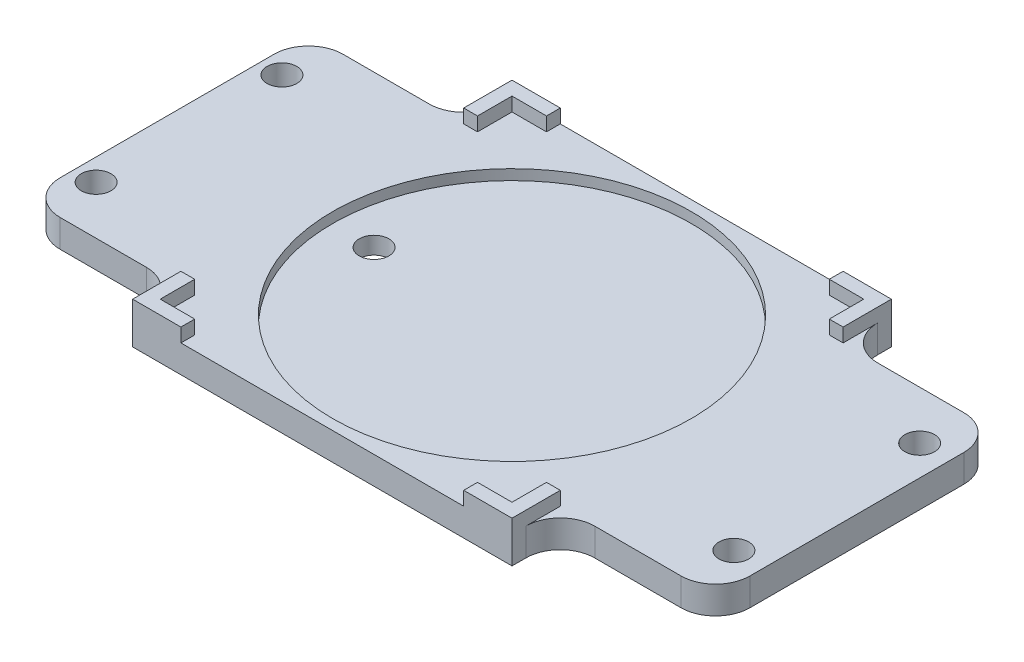
from build123d import *

# Parameters (mm, degrees)
SKETCH1_W               = 100
SKETCH1_H               = 55
BOSS_EXTRUDE1_DEPTH     = 4
F_6_CLEARANCE_HOLE1_D   = 4.3053
SKETCH4_R               = 26
CUT_EXTRUDE1_DEPTH      = 1.5
BOSS_EXTRUDE2_DEPTH     = 2
CUT_EXTRUDE2_REACH      = 59.204
SKETCH7_W               = 22.5
SKETCH7_H               = 7
MIRROR2_COPY_1_DEPTH    = 2
MIRROR2_COPY_2_REACH    = 59.204
MIRROR2_COPY_2_SKETCH_W = 22.5
MIRROR2_COPY_2_SKETCH_H = 7
FILLET1_R               = 5


with BuildPart() as part:
    # Sketch1 → Boss-Extrude1 (new body)
    with BuildSketch(Plane(origin=(0, 0, 0), x_dir=(1, 0, 0), z_dir=(0, 1, 0))):
        Rectangle(SKETCH1_W, SKETCH1_H)
    extrude(amount=BOSS_EXTRUDE1_DEPTH)

    # #6 Clearance Hole1 (through all)
    with Locations(Plane(origin=(0, 4, 0), x_dir=(1, 0, 0), z_dir=(0, 1, 0))):
        with Locations((45.6352, 13.470384182), (45.6352, -13.470384182), (-46.825, -13.470384182), (-46.825, 13.470384182), (-20, 0)):
            Hole(F_6_CLEARANCE_HOLE1_D / 2)

    # Sketch4 → Cut-Extrude1 (cut)
    with BuildSketch(Plane(origin=(0, 4, 0), x_dir=(1, 0, 0), z_dir=(0, 1, 0))):
        with Locations(Location((0, 0, 0), (0, 0, 270))):
            Circle(SKETCH4_R)
    extrude(amount=-CUT_EXTRUDE1_DEPTH, mode=Mode.SUBTRACT)

    # Sketch6 → Boss-Extrude2 (add)
    with BuildSketch(Plane(origin=(0, 4, 0), x_dir=(1, 0, 0), z_dir=(0, 1, 0))):
        Polygon((-20.5, 25.5), (-20.5, 27.5), (-27.5, 27.5), (-27.5, 20.5), (-25.5, 20.5), (-25.5, 25.5), align=None)
    boss_extrude2 = extrude(amount=BOSS_EXTRUDE2_DEPTH)

    # Sketch7 → Cut-Extrude2 (cut, up to next)
    with BuildSketch(Plane(origin=(0, 4, 0), x_dir=(1, 0, 0), z_dir=(0, 1, 0)), mode=Mode.PRIVATE) as cut_extrude2_sk1:
        with Locations((-38.75, 24)):
            Rectangle(SKETCH7_W, SKETCH7_H)
    cut_extrude2_tool1 = extrude(cut_extrude2_sk1.sketch, amount=-CUT_EXTRUDE2_REACH, mode=Mode.PRIVATE) & part.part
    cut_extrude2 = cut_extrude2_tool1.solids().sort_by_distance((-38.75, 4, -24))[0]
    add(cut_extrude2, mode=Mode.SUBTRACT)

    # Mirror1: Boss-Extrude2, Cut-Extrude2 across plane
    add(boss_extrude2.mirror(Plane.XY))
    add(cut_extrude2.mirror(Plane.XY), mode=Mode.SUBTRACT)

    # Mirror2: Boss-Extrude2, Cut-Extrude2 across plane
    add(boss_extrude2.mirror(Plane(origin=(0, 0, 0), x_dir=(0, 0, 1), z_dir=(1, 0, 0))))
    add(cut_extrude2.mirror(Plane(origin=(0, 0, 0), x_dir=(0, 0, 1), z_dir=(1, 0, 0))), mode=Mode.SUBTRACT)

    # Mirror2 copy 1 sketch → Mirror2 copy 1 (add)
    with BuildSketch(Plane(origin=(0, 4, 0), x_dir=(-1, 0, 0), z_dir=(0, 1, 0))):
        Polygon((-20.5, 25.5), (-20.5, 27.5), (-27.5, 27.5), (-27.5, 20.5), (-25.5, 20.5), (-25.5, 25.5), align=None)
    extrude(amount=MIRROR2_COPY_1_DEPTH)

    # Mirror2 copy 2 sketch → Mirror2 copy 2 (cut, up to next)
    with BuildSketch(Plane(origin=(0, 4, 0), x_dir=(-1, 0, 0), z_dir=(0, 1, 0)), mode=Mode.PRIVATE) as mirror2_copy_2_sk1:
        with Locations((-38.75, 24)):
            Rectangle(MIRROR2_COPY_2_SKETCH_W, MIRROR2_COPY_2_SKETCH_H)
    mirror2_copy_2_tool1 = extrude(mirror2_copy_2_sk1.sketch, amount=-MIRROR2_COPY_2_REACH, mode=Mode.PRIVATE) & part.part
    add(mirror2_copy_2_tool1.solids().sort_by_distance((38.75, 4, 24))[0], mode=Mode.SUBTRACT)

    # Fillet1
    fillet1_edges = [part.edges().sort_by_distance(p)[0] for p in [
        (-50, 2, 20.5),
        (-27.5, 2, 20.5),
        (50, 2, 20.5),
        (27.5, 2, 20.5),
        (50, 2, -20.5),
        (27.5, 2, -20.5),
        (-50, 2, -20.5),
        (-27.5, 2, -20.5),
    ]]
    fillet(fillet1_edges, radius=FILLET1_R)


solid = part.part
